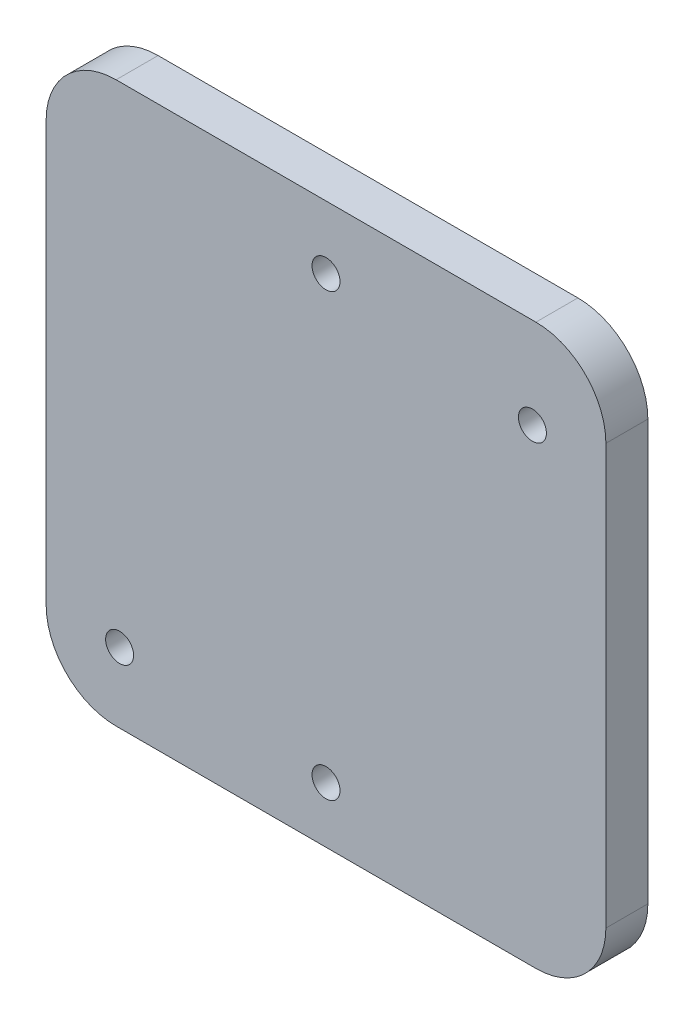
from build123d import *

# Parameters (mm, degrees)
BODY_DEPTH           = 6
SKETCH3_R            = 2
MOUNTING_HOLES_DEPTH = 57.885850613


with BuildPart() as part:
    # Sketch1 → Body (new body)
    with BuildSketch(Plane.XY):
        with BuildLine():
            Line((-30, 40), (30, 40))
            ThreePointArc((30, 40), (37.071067812, 37.071067812), (40, 30))
            Line((40, 30), (40, -30))
            ThreePointArc((40, -30), (37.071067812, -37.071067812), (30, -40))
            Line((30, -40), (-30, -40))
            ThreePointArc((-30, -40), (-37.071067812, -37.071067812), (-40, -30))
            Line((-40, -30), (-40, 30))
            ThreePointArc((-40, 30), (-37.071067812, 37.071067812), (-30, 40))
        make_face()
    extrude(amount=BODY_DEPTH)

    # Sketch3 → Mounting holes (cut, through all)
    with BuildSketch(Plane.XY.offset(6)):
        with Locations((0, 31)):
            Circle(SKETCH3_R)
        with Locations((29.5, 27)):
            Circle(SKETCH3_R)
        with Locations((0, -32)):
            Circle(SKETCH3_R)
        with Locations((-29.5, -30)):
            Circle(SKETCH3_R)
    extrude(amount=-MOUNTING_HOLES_DEPTH, mode=Mode.SUBTRACT)


solid = part.part
